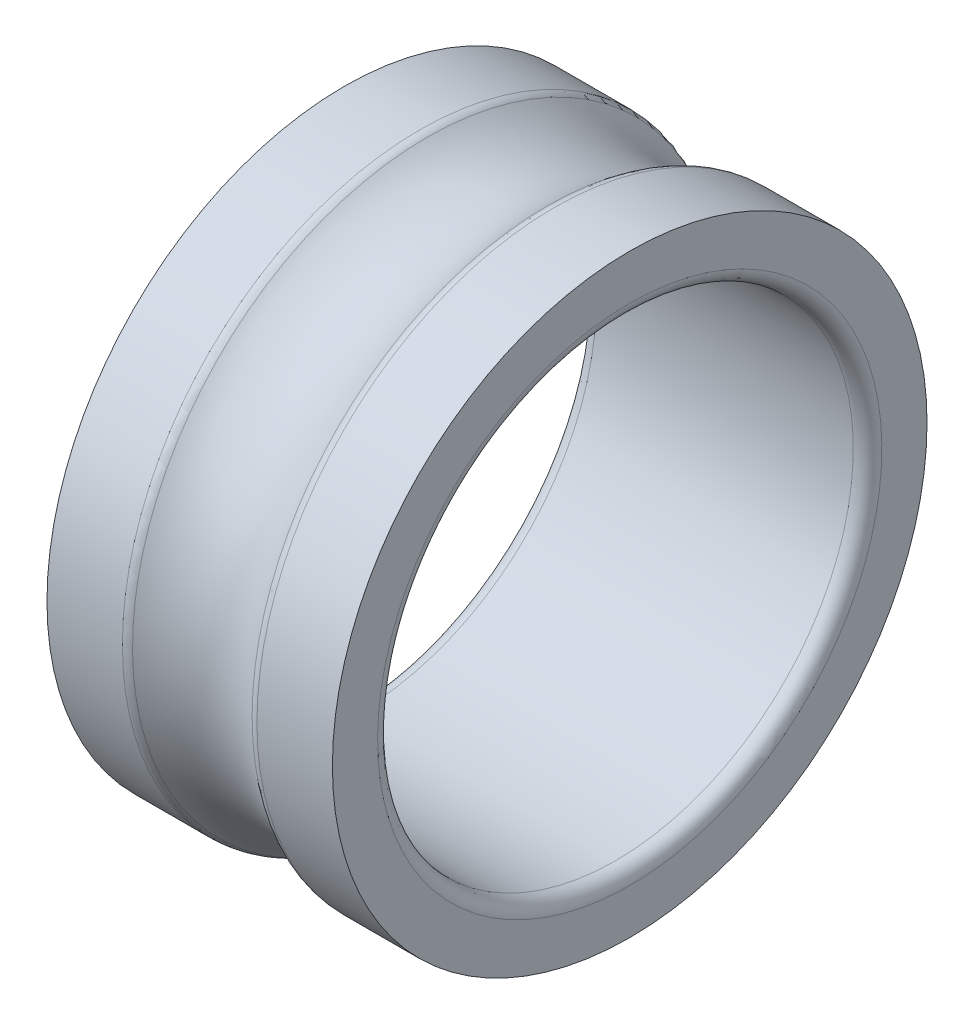
from build123d import *

# Parameters (mm, degrees)
FILLET1_R = 0.6
FILLET2_R = 0.5


with BuildPart() as part:
    # Sketch1 → Revolve1 (revolve)
    with BuildSketch(Plane.XY):
        with BuildLine():
            Line((-6, 12.5), (-6, 10))
            Line((-6, 10), (6, 10))
            Line((6, 10), (6, 12.5))
            Line((6, 12.5), (2.645751311, 12.5))
            ThreePointArc((2.645751311, 12.5), (0, 11.5), (-2.645751311, 12.5))
            Line((-2.645751311, 12.5), (-6, 12.5))
        make_face()
    revolve(axis=Axis((44.126443973, 0, 0), (-1, 0, 0)))

    # Fillet1
    fillet1_edges = [part.edges().sort_by_distance(p)[0] for p in [
        (6, -10, 0),
        (-6, -10, 0),
    ]]
    fillet(fillet1_edges, radius=FILLET1_R)

    # Fillet2
    fillet2_edges = [part.edges().sort_by_distance(p)[0] for p in [
        (2.645751311, -12.5, 0),
        (-2.645751311, -12.5, 0),
    ]]
    fillet(fillet2_edges, radius=FILLET2_R)


solid = part.part
